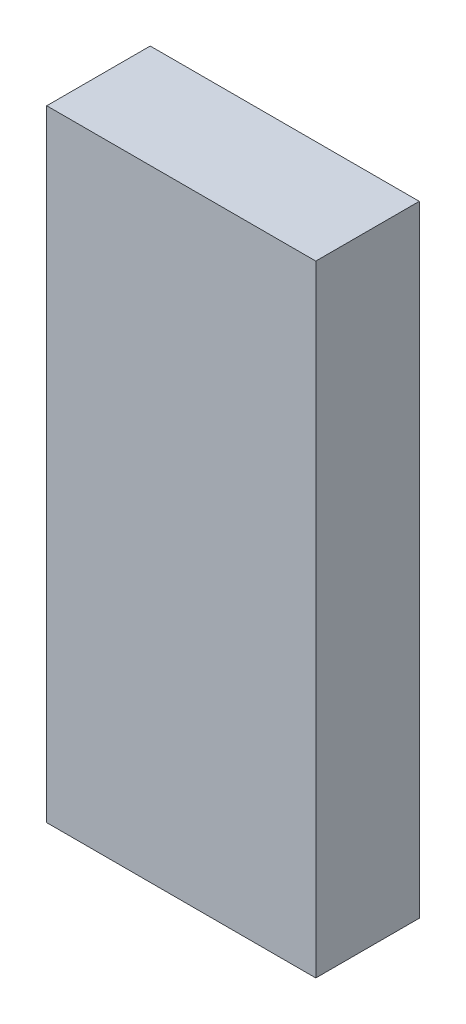
from build123d import *

# Parameters (mm, degrees)
SKETCH1_W           = 65
SKETCH1_H           = 25
BOSS_EXTRUDE1_DEPTH = 150


with BuildPart() as part:
    # Sketch1 → Boss-Extrude1 (new body)
    with BuildSketch(Plane(origin=(0, 0, 0), x_dir=(1, 0, 0), z_dir=(0, 1, 0))):
        with Locations((-8.781087981, -11.660636764)):
            Rectangle(SKETCH1_W, SKETCH1_H)
    extrude(amount=BOSS_EXTRUDE1_DEPTH)


solid = part.part
